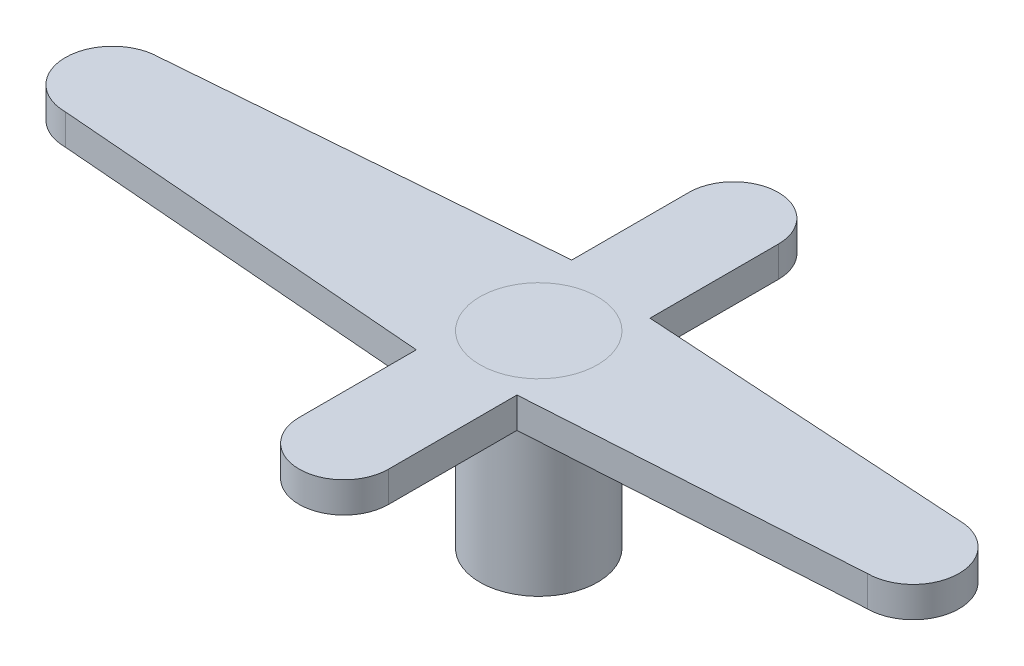
from build123d import *

# Parameters (mm, degrees)
SKETCH1_R           = 2.5
BOSS_EXTRUDE1_DEPTH = 8
SKETCH2_R           = 2
SKETCH2_R_2         = 1.95
BOSS_EXTRUDE2_DEPTH = 1.3


with BuildPart() as part:
    # Sketch1 → Boss-Extrude1 (new body)
    with BuildSketch(Plane(origin=(0, 0, 0), x_dir=(1, 0, 0), z_dir=(0, 1, 0))):
        with Locations(Location((0, 0, 0), (0, 0, 270))):
            Circle(SKETCH1_R)
    extrude(amount=BOSS_EXTRUDE1_DEPTH)


with BuildPart() as body_2:
    # Sketch2 → Boss-Extrude2 (new body)
    with BuildSketch(Plane(origin=(0, 8, 0), x_dir=(1, 0, 0), z_dir=(0, 1, 0))):
        with Locations((-18.1, 0)):
            Circle(SKETCH2_R)
        with BuildLine():
            ThreePointArc((-1.9, -1.624807681), (-2.5, 0), (-1.9, 1.624807681))
            Line((-1.9, 1.624807681), (-1.9, 3.3))
            Line((-1.9, 3.3), (-18.1, 2))
            ThreePointArc((-18.1, 2), (-16.685786438, 1.414213562), (-16.1, 0))
            ThreePointArc((-16.1, 0), (-16.685786438, -1.414213562), (-18.1, -2))
            Line((-18.1, -2), (-1.9, -3.3))
            Line((-1.9, -3.3), (-1.9, -1.624807681))
        make_face()
        with BuildLine():
            Line((1.9, 1.624807681), (1.9, 2.825))
            Line((1.9, 2.825), (1.9, 8.275))
            ThreePointArc((1.9, 8.275), (0, 6.375), (-1.9, 8.275))
            Line((-1.9, 8.275), (-1.9, 3.3))
            Line((-1.9, 3.3), (-1.9, 1.624807681))
            ThreePointArc((-1.9, 1.624807681), (0, 2.5), (1.9, 1.624807681))
        make_face()
        with BuildLine():
            ThreePointArc((-1.9, 8.275), (0, 6.375), (1.9, 8.275))
            Line((1.9, 8.275), (-1.9, 8.275))
        make_face()
        with BuildLine():
            Line((-1.9, 8.275), (1.9, 8.275))
            ThreePointArc((1.9, 8.275), (0, 10.175), (-1.9, 8.275))
        make_face()
        with BuildLine():
            Line((1.9, -2.825), (1.9, -1.624807681))
            ThreePointArc((1.9, -1.624807681), (0, -2.5), (-1.9, -1.624807681))
            Line((-1.9, -1.624807681), (-1.9, -3.3))
            Line((-1.9, -3.3), (-1.9, -8.275))
            ThreePointArc((-1.9, -8.275), (0, -6.375), (1.9, -8.275))
            Line((1.9, -8.275), (1.9, -2.825))
        make_face()
        with BuildLine():
            ThreePointArc((-1.9, -8.275), (0, -10.175), (1.9, -8.275))
            Line((1.9, -8.275), (-1.9, -8.275))
        make_face()
        with BuildLine():
            Line((-1.9, -8.275), (1.9, -8.275))
            ThreePointArc((1.9, -8.275), (0, -6.375), (-1.9, -8.275))
        make_face()
        with BuildLine():
            Line((15.9, 1.95), (1.9, 2.825))
            Line((1.9, 2.825), (1.9, 1.624807681))
            ThreePointArc((1.9, 1.624807681), (2.34520788, 0.866025404), (2.5, 0))
            ThreePointArc((2.5, 0), (2.34520788, -0.866025404), (1.9, -1.624807681))
            Line((1.9, -1.624807681), (1.9, -2.825))
            Line((1.9, -2.825), (15.9, -1.95))
            ThreePointArc((15.9, -1.95), (13.95, 0), (15.9, 1.95))
        make_face()
        with Locations((15.9, 0)):
            Circle(SKETCH2_R_2)
    extrude(amount=-BOSS_EXTRUDE2_DEPTH)


solid = Compound([part.part, body_2.part])
